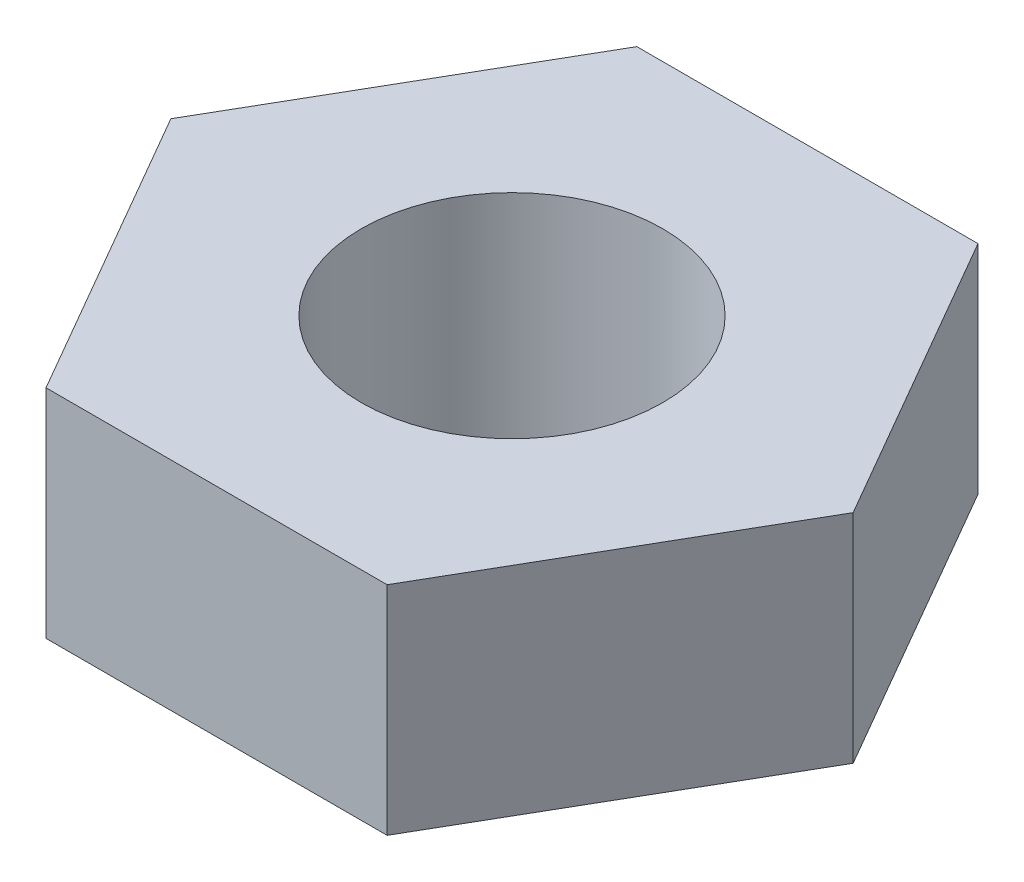
from build123d import *

# Parameters (mm, degrees)
SKETCH_1_R      = 1.25
EXTRUDE_1_DEPTH = 1.8


with BuildPart() as part:
    # 草图1 → 凸台-拉伸1 (new body)
    with BuildSketch(Plane(origin=(0, 0, 0), x_dir=(1, 0, 0), z_dir=(0, 1, 0))):
        Polygon((-1.41450816, -2.45), (1.41450816, -2.45), (2.829016319, 0), (1.41450816, 2.45), (-1.41450816, 2.45), (-2.829016319, 0), align=None)
        with Locations(Location((0, 0, 0), (0, 0, 270))):
            Circle(SKETCH_1_R, mode=Mode.SUBTRACT)
    extrude(amount=EXTRUDE_1_DEPTH)


solid = part.part
